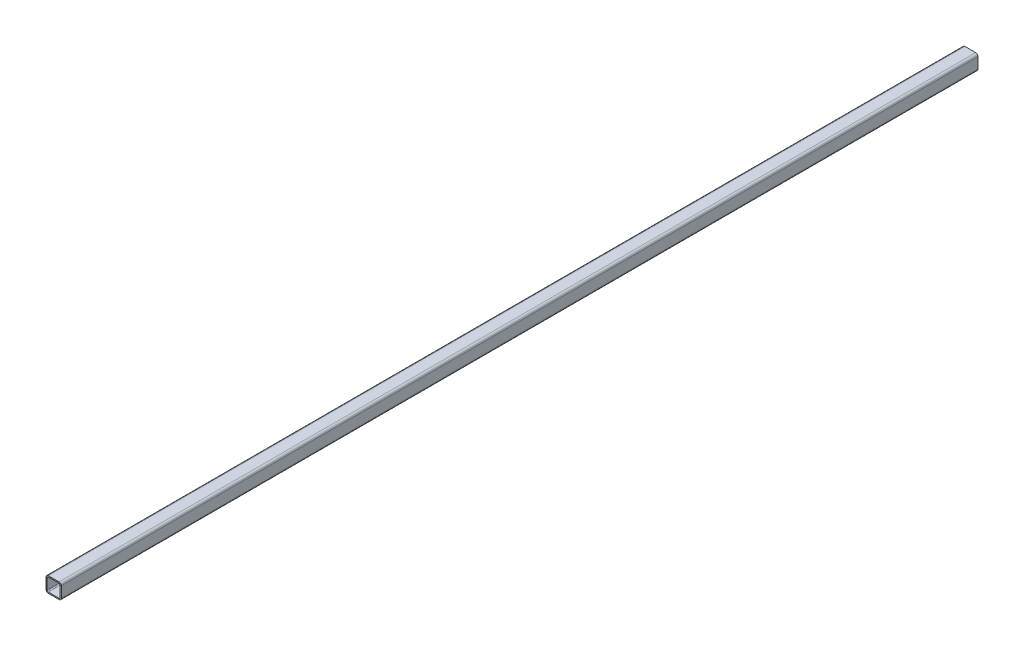
from build123d import *

# Parameters (mm, degrees)
EXTRUDE_1_DEPTH = 1196.5


with BuildPart() as part:
    # Эскиз1 → Бобышка-Вытянуть1 (new, symmetric)
    with BuildSketch(Plane.XY):
        with BuildLine():
            Line((-14, 20), (14, 20))
            ThreePointArc((14, 20), (18.242640687, 18.242640687), (20, 14))
            Line((20, 14), (20, -14))
            ThreePointArc((20, -14), (18.242640687, -18.242640687), (14, -20))
            Line((14, -20), (-14, -20))
            ThreePointArc((-14, -20), (-18.242640687, -18.242640687), (-20, -14))
            Line((-20, -14), (-20, 14))
            ThreePointArc((-20, 14), (-18.242640687, 18.242640687), (-14, 20))
        make_face()
        with BuildLine():
            Line((-14, 17), (14, 17))
            ThreePointArc((14, 17), (16.121320344, 16.121320344), (17, 14))
            Line((17, 14), (17, -14))
            ThreePointArc((17, -14), (16.121320344, -16.121320344), (14, -17))
            Line((14, -17), (-14, -17))
            ThreePointArc((-14, -17), (-16.121320344, -16.121320344), (-17, -14))
            Line((-17, -14), (-17, 14))
            ThreePointArc((-17, 14), (-16.121320344, 16.121320344), (-14, 17))
        make_face(mode=Mode.SUBTRACT)
    extrude(amount=EXTRUDE_1_DEPTH, both=True)


solid = part.part
